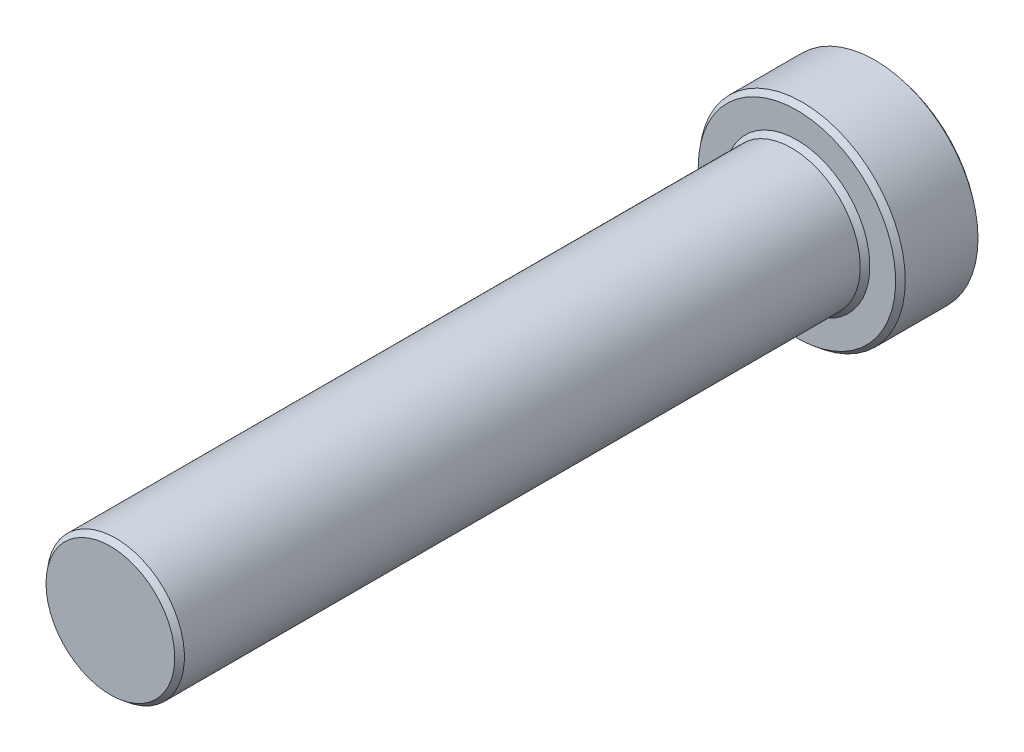
from build123d import *


with BuildPart() as part:
    # Sketch1 → Revolve1 (revolve)
    with BuildSketch(Plane(origin=(0, 0, 0), x_dir=(1, 0, 0), z_dir=(0, 1, 0))):
        Polygon((-10, 21.297440492), (-10, -77.140821889), (-9.375304952, -77.921690698), (0, -77.921690698), (0, 34.078309302), (-14.219131191, 34.078309302), (-15, 33.453614254), (-15, 22.859178111), (-14.375304952, 22.078309302), (-10.624695048, 22.078309302), align=None)
    revolve(axis=Axis((0, 0, -35.844660194), (0, 0, 1)))


solid = part.part
